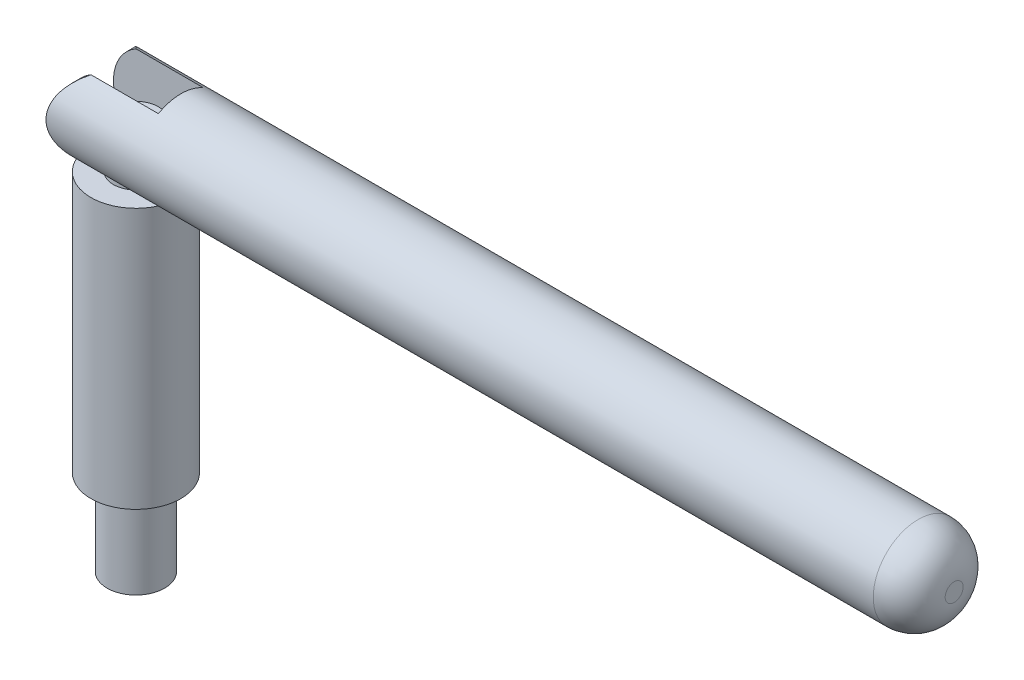
from build123d import *

# Parameters (mm, degrees)
SKETCH1_R                = 5
BOSS_EXTRUDE1_DEPTH      = 29
SKETCH2_R                = 2.5
BOSS_EXTRUDE2_DEPTH      = 5
SKETCH4_R                = 3.2
BOSS_EXTRUDE3_DEPTH      = 9.525
BOSS_EXTRUDE4_DEPTH      = 86
BOSS_EXTRUDE4_DEPTH_BACK = 10
SKETCH5_R                = 5
FILLET1_R                = 4
SKETCH8_W                = 10
SKETCH8_H                = 5
CUT_EXTRUDE2_DEPTH       = 99.945316429
CUT_EXTRUDE3_DEPTH       = 100.131226252
CUT_EXTRUDE3_DEPTH_BACK  = 100.131226252


with BuildPart() as part:
    # Sketch1 → Boss-Extrude1 (new body)
    with BuildSketch(Plane(origin=(0, 0, 0), x_dir=(1, 0, 0), z_dir=(0, 1, 0))):
        with Locations(Location((0, 0, 0), (0, 0, 90))):
            Circle(SKETCH1_R)
    extrude(amount=BOSS_EXTRUDE1_DEPTH)

    # Sketch2 → Boss-Extrude2 (add)
    with BuildSketch(Plane(origin=(0, 29, 0), x_dir=(1, 0, 0), z_dir=(0, 1, 0))):
        with Locations(Location((0, 0, 0), (0, 0, 270))):
            Circle(SKETCH2_R)
    extrude(amount=BOSS_EXTRUDE2_DEPTH)

    # Sketch4 → Boss-Extrude3 (add)
    with BuildSketch(Plane.XZ):
        with Locations(Location((0, 0, 0), (0, 0, 90))):
            Circle(SKETCH4_R)
    extrude(amount=BOSS_EXTRUDE3_DEPTH)


with BuildPart() as body_2:
    # Sketch5 → Boss-Extrude4 (new, two sides: drawn at the far end of the back side and taken through both)
    with BuildSketch(Plane(origin=(5, 0, 0), x_dir=(0, 0, -1), z_dir=(1, 0, 0)).offset(-BOSS_EXTRUDE4_DEPTH_BACK)):
        with Locations((0, 34)):
            Circle(SKETCH5_R)
    extrude(amount=BOSS_EXTRUDE4_DEPTH + BOSS_EXTRUDE4_DEPTH_BACK)

    # Fillet1
    fillet1_edges = [body_2.edges().sort_by_distance(p)[0] for p in [
        (91, 34, 5),
    ]]
    fillet(fillet1_edges, radius=FILLET1_R)

    # Sketch8 → Cut-Extrude2 (cut, through all)
    with BuildSketch(Plane(origin=(0, 29, 0), x_dir=(1, 0, 0), z_dir=(0, 1, 0))):
        Rectangle(SKETCH8_W, SKETCH8_H)
    extrude(amount=CUT_EXTRUDE2_DEPTH, mode=Mode.SUBTRACT)

    # Sketch9 → Cut-Extrude3 (cut, two sides: drawn at the far end of the back side and taken through both)
    with BuildSketch(Plane.XY.offset(-CUT_EXTRUDE3_DEPTH_BACK)):
        with BuildLine():
            Line((-5, 34), (-5, 29))
            Line((-5, 29), (0, 29))
            ThreePointArc((0, 29), (-3.535533906, 30.464466094), (-5, 34))
        make_face()
        with BuildLine():
            Line((-5, 39), (-5, 34))
            ThreePointArc((-5, 34), (-3.535533906, 37.535533906), (0, 39))
            Line((0, 39), (-5, 39))
        make_face()
    extrude(amount=CUT_EXTRUDE3_DEPTH + CUT_EXTRUDE3_DEPTH_BACK, mode=Mode.SUBTRACT)


solid = Compound([part.part, body_2.part])
